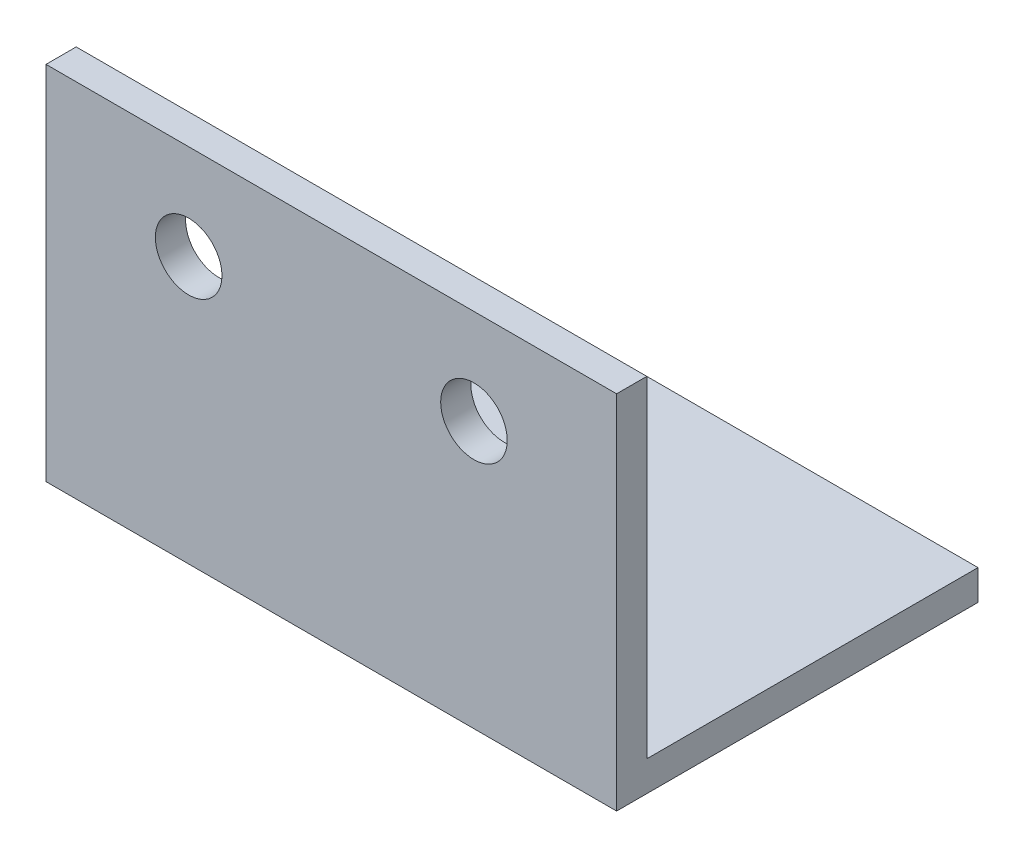
from build123d import *

# Parameters (mm, degrees)
SKETCH1_W               = 30
SKETCH1_H               = 38
BOSS_EXTRUDE1_DEPTH     = 3.175
SKETCH2_W               = 30
SKETCH2_H               = 3.175
BOSS_EXTRUDE2_DEPTH     = 34.825
SKETCH3_R               = 4
CUT_EXTRUDE1_DEPTH      = 60.638751035
SKETCH4_R               = 4
CUT_EXTRUDE2_DEPTH      = 58.667679423
CROQUIS4_R              = 4
CROQUIS4_R_2            = 3.5
SALIENTE_EXTRUIR2_DEPTH = 5
CROQUIS5_W              = 3.979032683
CROQUIS5_H              = 10.100326852
CORTAR_EXTRUIR1_DEPTH   = 36
CROQUIS6_W              = 38
CROQUIS6_H              = 3.175
SALIENTE_EXTRUIR3_DEPTH = 30
CROQUIS7_W              = 3.175
CROQUIS7_H              = 34.825
SALIENTE_EXTRUIR4_DEPTH = 30
CROQUIS8_R              = 3.5
CORTAR_EXTRUIR2_DEPTH   = 30
CROQUIS9_W              = 28.045440503
CROQUIS9_H              = 19.668665091
SALIENTE_EXTRUIR5_DEPTH = 9
CROQUIS10_W             = 26.699428358
CROQUIS10_H             = 12.946692093
CORTAR_EXTRUIR3_DEPTH   = 65
CROQUIS11_R             = 3.5
CORTAR_EXTRUIR4_DEPTH   = 65


with BuildPart() as part:
    # Sketch1 → Boss-Extrude1 (new body)
    with BuildSketch(Plane.XY):
        with Locations((15, 19)):
            Rectangle(SKETCH1_W, SKETCH1_H)
    extrude(amount=BOSS_EXTRUDE1_DEPTH)

    # Sketch2 → Boss-Extrude2 (add)
    with BuildSketch(Plane(origin=(0, 0, 0), x_dir=(-1, 0, 0), z_dir=(0, 0, -1))):
        with Locations((-15, 1.5875)):
            Rectangle(SKETCH2_W, SKETCH2_H)
    extrude(amount=BOSS_EXTRUDE2_DEPTH)

    # Sketch3 → Cut-Extrude1 (cut, through all)
    with BuildSketch(Plane(origin=(0, 0, 0), x_dir=(-1, 0, 0), z_dir=(0, 0, -1))):
        with Locations((-15, 28)):
            Circle(SKETCH3_R)
    extrude(amount=-CUT_EXTRUDE1_DEPTH, mode=Mode.SUBTRACT)

    # Sketch4 → Cut-Extrude2 (cut, through all)
    with BuildSketch(Plane(origin=(0, 3.175, 0), x_dir=(1, 0, 0), z_dir=(0, 1, 0))):
        with Locations(Location((15, 24.825, 0), (0, 0, 180))):
            Circle(SKETCH4_R)
    extrude(amount=-CUT_EXTRUDE2_DEPTH, mode=Mode.SUBTRACT)

    # Croquis4 → Saliente-Extruir2 (add)
    with BuildSketch(Plane(origin=(0, 0, 0), x_dir=(-1, 0, 0), z_dir=(0, 0, -1))):
        with Locations((-15, 28)):
            Circle(CROQUIS4_R)
        with Locations((-15, 28)):
            Circle(CROQUIS4_R_2, mode=Mode.SUBTRACT)
    extrude(amount=-SALIENTE_EXTRUIR2_DEPTH)

    # Croquis5 → Cortar-Extruir1 (cut)
    with BuildSketch(Plane.ZY):
        with Locations((5.164516342, 27.585777405)):
            Rectangle(CROQUIS5_W, CROQUIS5_H)
    extrude(amount=-CORTAR_EXTRUIR1_DEPTH, mode=Mode.SUBTRACT)

    # Croquis6 → Saliente-Extruir3 (add)
    with BuildSketch(Plane.ZY):
        with Locations((-15.825, 1.5875)):
            Rectangle(CROQUIS6_W, CROQUIS6_H)
    extrude(amount=SALIENTE_EXTRUIR3_DEPTH)

    # Croquis7 → Saliente-Extruir4 (add)
    with BuildSketch(Plane.ZY):
        with Locations((1.5875, 20.5875)):
            Rectangle(CROQUIS7_W, CROQUIS7_H)
    extrude(amount=SALIENTE_EXTRUIR4_DEPTH)

    # Croquis8 → Cortar-Extruir2 (cut)
    with BuildSketch(Plane(origin=(0, 0, 0), x_dir=(-1, 0, 0), z_dir=(0, 0, -1))):
        with Locations((15, 28)):
            Circle(CROQUIS8_R)
    extrude(amount=-CORTAR_EXTRUIR2_DEPTH, mode=Mode.SUBTRACT)

    # Croquis9 → Saliente-Extruir5 (add)
    with BuildSketch(Plane(origin=(0, 3.175, 0), x_dir=(1, 0, 0), z_dir=(0, 1, 0))):
        with Locations((15.977279749, 24.990667455)):
            Rectangle(CROQUIS9_W, CROQUIS9_H)
    extrude(amount=-SALIENTE_EXTRUIR5_DEPTH)

    # Croquis10 → Cortar-Extruir3 (cut)
    with BuildSketch(Plane.ZY.offset(30)):
        with Locations((-21.475285821, -6.473346047)):
            Rectangle(CROQUIS10_W, CROQUIS10_H)
    extrude(amount=-CORTAR_EXTRUIR3_DEPTH, mode=Mode.SUBTRACT)

    # Croquis11 → Cortar-Extruir4 (cut)
    with BuildSketch(Plane(origin=(0, 3.175, 0), x_dir=(1, 0, 0), z_dir=(0, 1, 0))):
        with Locations(Location((0, 24.825, 0), (0, 0, 180))):
            Circle(CROQUIS11_R)
    extrude(amount=-CORTAR_EXTRUIR4_DEPTH, mode=Mode.SUBTRACT)


solid = part.part
